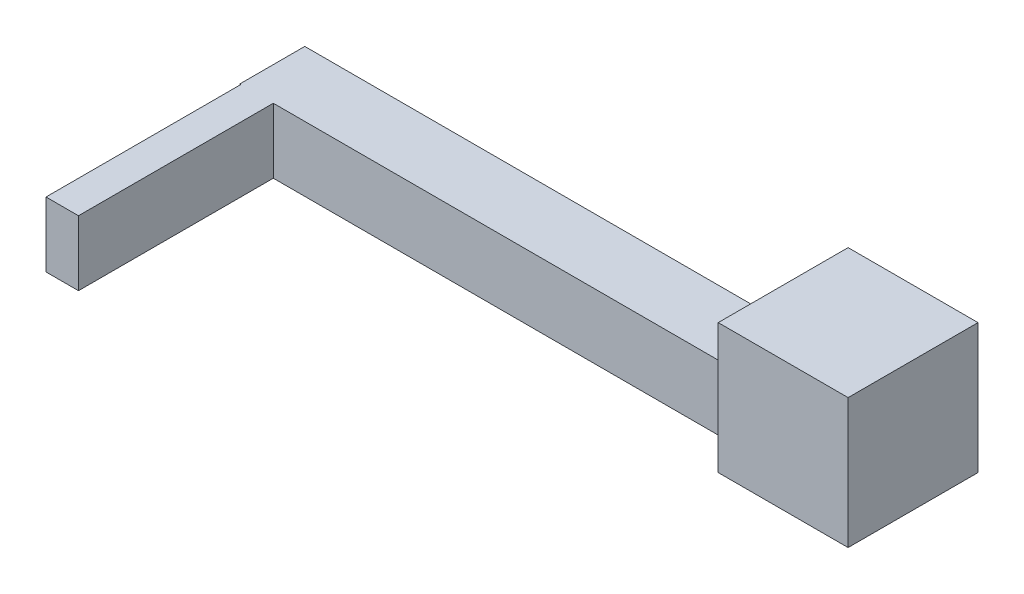
from build123d import *

# Parameters (mm, degrees)
SKETCH3_W           = 20
SKETCH3_H           = 20
BOSS_EXTRUDE2_DEPTH = 20
SKETCH1_W           = 80
SKETCH1_H           = 10
BOSS_EXTRUDE3_DEPTH = 10
SKETCH6_W           = 5
SKETCH6_H           = 30
BOSS_EXTRUDE4_DEPTH = 10


with BuildPart() as part:
    # Sketch3 → Boss-Extrude2 (new body)
    with BuildSketch(Plane(origin=(0, 0, 0), x_dir=(1, 0, 0), z_dir=(0, 1, 0))):
        with Locations((48.654441815, 0)):
            Rectangle(SKETCH3_W, SKETCH3_H)
    extrude(amount=BOSS_EXTRUDE2_DEPTH)

    # Sketch1 → Boss-Extrude3 (add)
    with BuildSketch(Plane(origin=(0, 0, 0), x_dir=(1, 0, 0), z_dir=(0, 1, 0))):
        Rectangle(SKETCH1_W, SKETCH1_H)
    extrude(amount=BOSS_EXTRUDE3_DEPTH)

    # Sketch6 → Boss-Extrude4 (add)
    with BuildSketch(Plane(origin=(0, 0, 0), x_dir=(1, 0, 0), z_dir=(0, 1, 0))):
        with Locations((-37.345197049, -20)):
            Rectangle(SKETCH6_W, SKETCH6_H)
    extrude(amount=BOSS_EXTRUDE4_DEPTH)


solid = part.part
